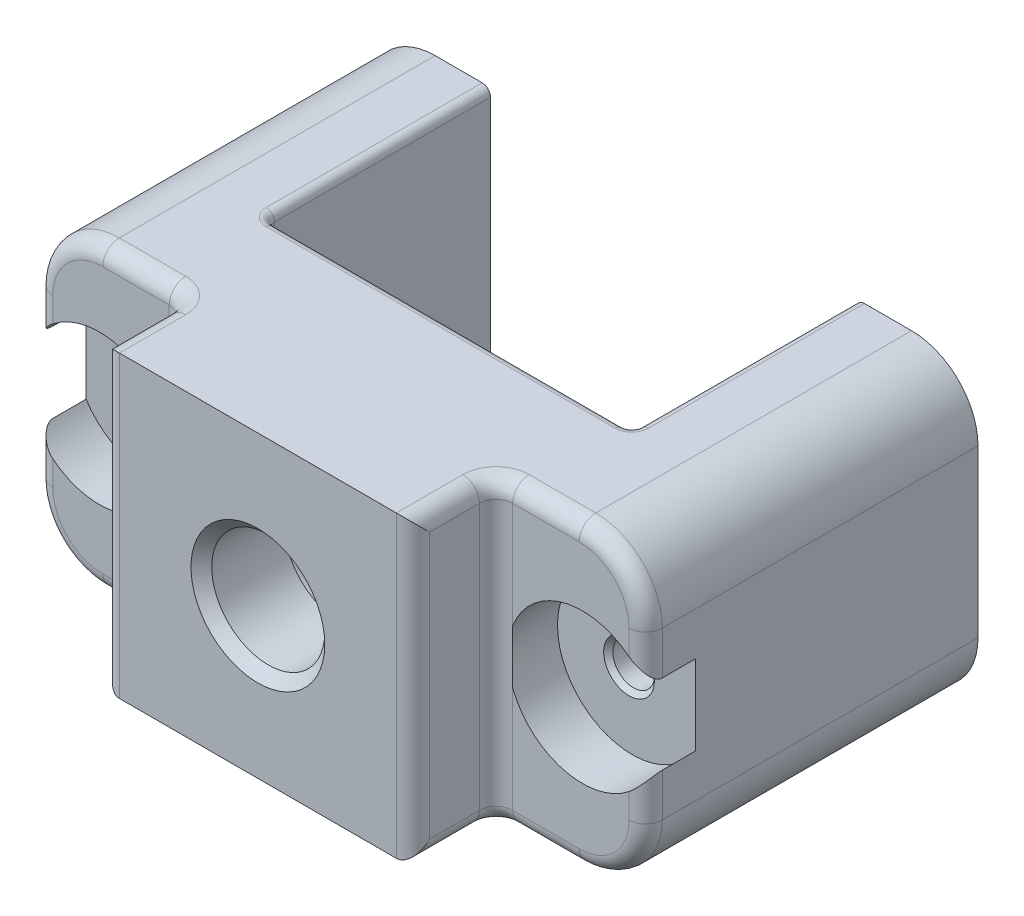
from build123d import *

# Parameters (mm, degrees)
SKETCH1_R                        = 5.5
SKETCH1_R_2                      = 1
BOSS_EXTRUDE1_DEPTH              = 15
SKETCH3_W                        = 9.999397818
SKETCH3_H                        = 22.225224056
CUT_EXTRUDE1_DEPTH               = 5
FILLET1_R                        = 1
FILLET1_OF_MIRROR1_R             = 1
SKETCH4_R                        = 7.5
BOSS_EXTRUDE2_DEPTH              = 5
SKETCH5_W                        = 22
SKETCH5_H                        = 7
CUT_EXTRUDE2_DEPTH               = 30.75172255
SKETCH6_R                        = 3
CUT_EXTRUDE3_DEPTH               = 26.34097462
SKETCH7_R                        = 4.5
CUT_EXTRUDE8_DEPTH               = 3
FILLET3_R                        = 0.5
FILLET2_R                        = 0.5
BOSS_EXTRUDE3_START              = 10
SKETCH8_R                        = 1
BOSS_EXTRUDE3_DEPTH              = 10
M8X1_25_TAPPED_HOLE1_D           = 6.8
M8X1_25_TAPPED_HOLE1_CSINK_D     = 8.05
M8X1_25_TAPPED_HOLE1_CSINK_ANGLE = 90
FILLET4_R                        = 0.5
M3X0_5_TAPPED_HOLE1_D            = 2.5
M3X0_5_TAPPED_HOLE1_CSINK_D      = 3.05
M3X0_5_TAPPED_HOLE1_CSINK_ANGLE  = 90


with BuildPart() as part:
    # Sketch1 → Boss-Extrude1 (new body)
    with BuildSketch(Plane.XY):
        with BuildLine():
            Line((-14.334802826, 9), (14.334802826, 9))
            ThreePointArc((14.334802826, 9), (17.163229951, 7.828427125), (18.334802826, 5))
            Line((18.334802826, 5), (18.334802826, -5))
            ThreePointArc((18.334802826, -5), (17.163229951, -7.828427125), (14.334802826, -9))
            Line((14.334802826, -9), (-14.334802826, -9))
            ThreePointArc((-14.334802826, -9), (-17.163229951, -7.828427125), (-18.334802826, -5))
            Line((-18.334802826, -5), (-18.334802826, 5))
            ThreePointArc((-18.334802826, 5), (-17.163229951, 7.828427125), (-14.334802826, 9))
        make_face()
        Circle(SKETCH1_R, mode=Mode.SUBTRACT)
        with Locations((-14.334802826, 0)):
            Circle(SKETCH1_R_2, mode=Mode.SUBTRACT)
        with Locations(Location((14.334802826, 0, 0), (0, 0, 180))):
            Circle(SKETCH1_R_2, mode=Mode.SUBTRACT)
    extrude(amount=BOSS_EXTRUDE1_DEPTH)

    # Sketch3 → Cut-Extrude1 (cut)
    with BuildSketch(Plane.XY.offset(15)):
        with Locations((-14.334501735, -0.429661625)):
            Rectangle(SKETCH3_W, SKETCH3_H)
    cut_extrude1 = extrude(amount=-CUT_EXTRUDE1_DEPTH, mode=Mode.SUBTRACT)

    # Fillet1
    fillet1_edges = [part.edges().sort_by_distance(p)[0] for p in [
        (-9.334802826, -9, 12.5),
        (-9.334802826, 0, 10),
        (-9.334802826, 9, 12.5),
        (-17.163229951, 7.828427125, 10),
        (-11.834802826, 9, 10),
        (-11.834802826, -9, 10),
        (-17.163229951, -7.828427125, 10),
        (-18.334802826, 0, 10),
        (-9.334802826, 0, 15),
    ]]
    fillet(fillet1_edges, radius=FILLET1_R)

    # Mirror1: Cut-Extrude1 across plane
    add(cut_extrude1.mirror(Plane(origin=(0, 0, 0), x_dir=(0, 0, 1), z_dir=(1, 0, 0))), mode=Mode.SUBTRACT)

    # Fillet1 of Mirror1
    fillet1_of_mirror1_edges = [part.edges().sort_by_distance(p)[0] for p in [
        (9.334802826, -9, 12.5),
        (9.334802826, 0, 10),
        (9.334802826, 9, 12.5),
        (17.163229951, 7.828427125, 10),
        (11.834802826, 9, 10),
        (11.834802826, -9, 10),
        (17.163229951, -7.828427125, 10),
        (18.334802826, 0, 10),
        (9.334802826, 0, 15),
    ]]
    fillet(fillet1_of_mirror1_edges, radius=FILLET1_OF_MIRROR1_R)

    # Sketch4 → Boss-Extrude2 (add)
    with BuildSketch(Plane.XY.offset(15)):
        Circle(SKETCH4_R)
    extrude(amount=-BOSS_EXTRUDE2_DEPTH)

    # Sketch5 → Cut-Extrude2 (cut, through all)
    with BuildSketch(Plane(origin=(0, 9, 0), x_dir=(1, 0, 0), z_dir=(0, 1, 0))):
        Rectangle(SKETCH5_W, SKETCH5_H)
    extrude(amount=-CUT_EXTRUDE2_DEPTH, mode=Mode.SUBTRACT)

    # Sketch6 → Cut-Extrude3 (cut, through all)
    with BuildSketch(Plane.XY.offset(15)):
        Circle(SKETCH6_R)
    extrude(amount=-CUT_EXTRUDE3_DEPTH, mode=Mode.SUBTRACT)

    # Sketch7 → Cut-Extrude8 (cut)
    with BuildSketch(Plane.XY.offset(10)):
        with Locations((-14.530374954, 0)):
            Circle(SKETCH7_R)
        with Locations((14.530374954, 0)):
            Circle(SKETCH7_R)
    extrude(amount=-CUT_EXTRUDE8_DEPTH, mode=Mode.SUBTRACT)

    # Fillet3
    fillet3_edges = [part.edges().sort_by_distance(p)[0] for p in [
        (11, -9, 1.75),
        (0, -9, 3.5),
        (11, 0, 3.5),
        (-11, -9, 1.75),
        (-11, 0, 3.5),
        (-11, 9, 1.75),
        (0, 9, 3.5),
        (11, 9, 1.75),
    ]]
    fillet(fillet3_edges, radius=FILLET3_R)

    # Fillet2
    fillet2_edges = [part.edges().sort_by_distance(p)[0] for p in [
        (-5.5, 0, 10),
    ]]
    fillet(fillet2_edges, radius=FILLET2_R)

    # Sketch8 → Boss-Extrude3 (add)
    # profile 1 of 2: a face of its own
    with BuildSketch(Plane(origin=(0, 0, 0), x_dir=(-1, 0, 0), z_dir=(0, 0, -1)).offset(BOSS_EXTRUDE3_START)):
        with BuildLine():
            Line((11, 8.5), (11, -8.5))
            ThreePointArc((11, -8.5), (11.146446609, -8.853553391), (11.5, -9))
            Line((11.5, -9), (14.334802826, -9))
            ThreePointArc((14.334802826, -9), (17.163229951, -7.828427125), (18.334802826, -5))
            Line((18.334802826, -5), (18.334802826, 5))
            ThreePointArc((18.334802826, 5), (17.163229951, 7.828427125), (14.334802826, 9))
            Line((14.334802826, 9), (11.5, 9))
            ThreePointArc((11.5, 9), (11.146446609, 8.853553391), (11, 8.5))
        make_face()
        with Locations((14.334802826, 0)):
            Circle(SKETCH8_R, mode=Mode.SUBTRACT)
    # profile 2 of 2: a face of its own
    with BuildSketch(Plane(origin=(0, 0, 0), x_dir=(-1, 0, 0), z_dir=(0, 0, -1)).offset(BOSS_EXTRUDE3_START)):
        with BuildLine():
            Line((-14.334802826, -9), (-11.5, -9))
            ThreePointArc((-11.5, -9), (-11.146446609, -8.853553391), (-11, -8.5))
            Line((-11, -8.5), (-11, 8.5))
            ThreePointArc((-11, 8.5), (-11.146446609, 8.853553391), (-11.5, 9))
            Line((-11.5, 9), (-14.334802826, 9))
            ThreePointArc((-14.334802826, 9), (-17.163229951, 7.828427125), (-18.334802826, 5))
            Line((-18.334802826, 5), (-18.334802826, -5))
            ThreePointArc((-18.334802826, -5), (-17.163229951, -7.828427125), (-14.334802826, -9))
        make_face()
        with Locations((-14.334802826, 0)):
            Circle(SKETCH8_R, mode=Mode.SUBTRACT)
    extrude(amount=-BOSS_EXTRUDE3_DEPTH)

    # M8x1.25 Tapped Hole1 (through all)
    with Locations(Plane.XY.offset(15)):
        with Locations((0, 0)):
            CounterSinkHole(M8X1_25_TAPPED_HOLE1_D / 2, M8X1_25_TAPPED_HOLE1_CSINK_D / 2, counter_sink_angle=M8X1_25_TAPPED_HOLE1_CSINK_ANGLE)

    # Fillet4
    fillet4_edges = [part.edges().sort_by_distance(p)[0] for p in [
        (-5.5, 0, 3.5),
    ]]
    fillet(fillet4_edges, radius=FILLET4_R)

    # M3x0.5 Tapped Hole1 (through all)
    with Locations(Plane(origin=(-14.334802826, 0, 7), x_dir=(1, 0, 0), z_dir=(0, 0, 1))):
        with Locations((0, 0), (28.669605652, 0)):
            CounterSinkHole(M3X0_5_TAPPED_HOLE1_D / 2, M3X0_5_TAPPED_HOLE1_CSINK_D / 2, counter_sink_angle=M3X0_5_TAPPED_HOLE1_CSINK_ANGLE)


solid = part.part
